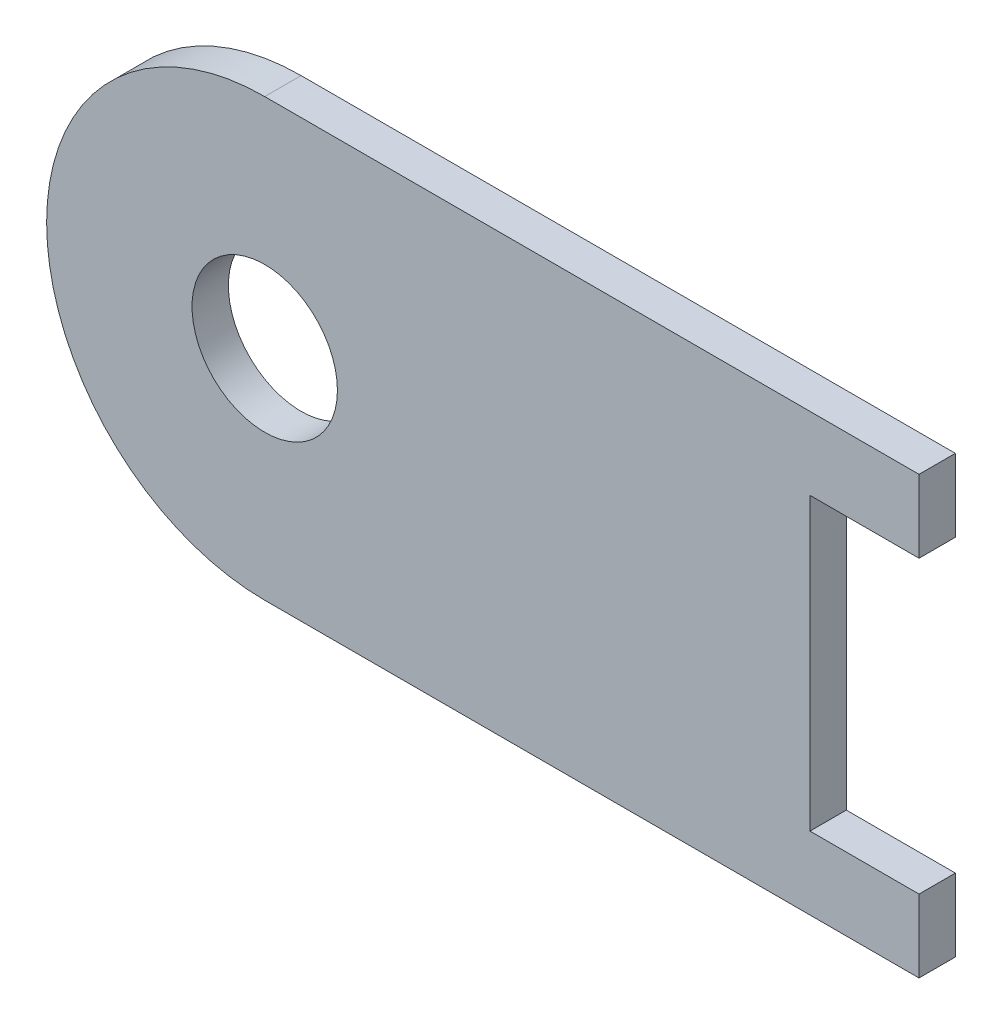
from build123d import *

# Parameters (mm, degrees)
SKETCH1_R           = 20
BOSS_EXTRUDE2_DEPTH = 10


with BuildPart() as part:
    # Sketch1 → Boss-Extrude2 (new body)
    with BuildSketch(Plane.XY):
        with BuildLine():
            Line((-28.320181146, 0), (151.679818854, 0))
            Line((151.679818854, 0), (151.679818854, 20))
            Line((151.679818854, 20), (121.679818854, 20))
            Line((121.679818854, 20), (121.679818854, 100))
            Line((121.679818854, 100), (151.679818854, 100))
            Line((151.679818854, 100), (151.679818854, 120))
            Line((151.679818854, 120), (-28.320181146, 120))
            ThreePointArc((-28.320181146, 120), (-88.320181146, 60), (-28.320181146, 0))
        make_face()
        with Locations((-28.320181146, 60)):
            Circle(SKETCH1_R, mode=Mode.SUBTRACT)
    extrude(amount=BOSS_EXTRUDE2_DEPTH)


solid = part.part
